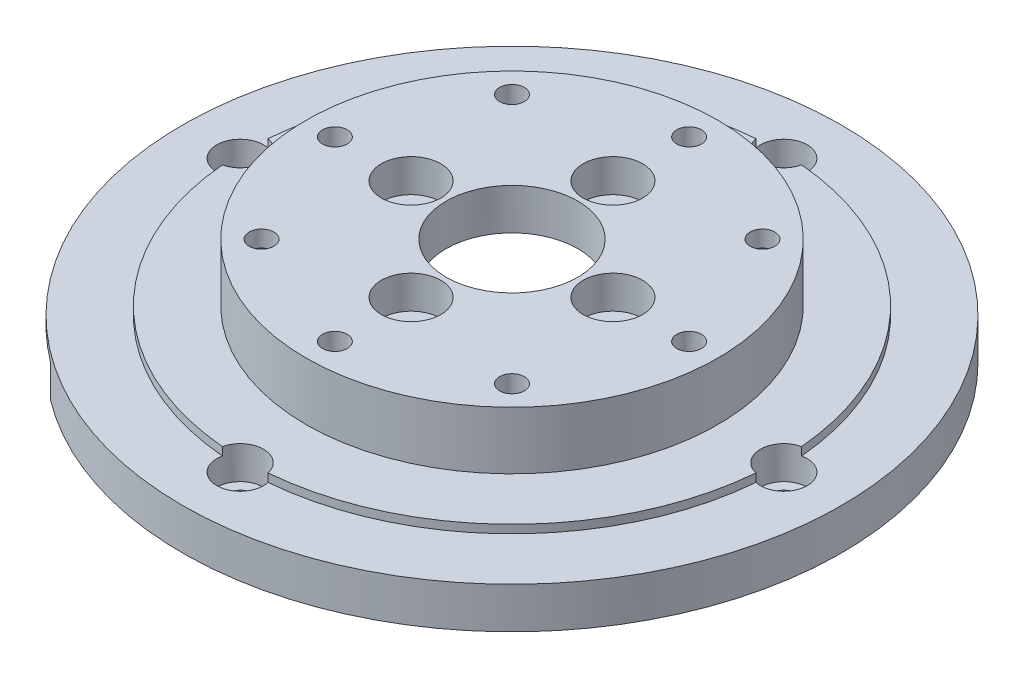
from build123d import *

# Parameters (mm, degrees)
SKETCH1_R           = 40
BOSS_EXTRUDE1_DEPTH = 5
SKETCH4_R           = 32.5
BOSS_EXTRUDE2_DEPTH = 1
SKETCH5_R           = 25
BOSS_EXTRUDE3_DEPTH = 7
SKETCH6_R           = 2
SKETCH6_R_2         = 8
CUT_EXTRUDE1_DEPTH  = 59.043087444
SKETCH7_R           = 30
CUT_EXTRUDE2_DEPTH  = 4
SKETCH8_R           = 24
CUT_EXTRUDE3_DEPTH  = 4
SKETCH9_R           = 3.61
CUT_EXTRUDE4_DEPTH  = 4
SKETCH10_R          = 1.57
CUT_EXTRUDE5_DEPTH  = 59.043087444
SKETCH11_R          = 2.84
CUT_EXTRUDE6_DEPTH  = 4
SKETCH12_R          = 1.5
CUT_EXTRUDE7_DEPTH  = 4
CUT_EXTRUDE9_DEPTH  = 7
CUT_EXTRUDE10_DEPTH = 4


with BuildPart() as part:
    # Sketch1 → Boss-Extrude1 (new body)
    with BuildSketch(Plane(origin=(0, 0, 0), x_dir=(1, 0, 0), z_dir=(0, 1, 0))):
        with Locations(Location((0, 0, 0), (0, 0, 270))):
            Circle(SKETCH1_R)
    extrude(amount=BOSS_EXTRUDE1_DEPTH)

    # Sketch4 → Boss-Extrude2 (add)
    with BuildSketch(Plane(origin=(0, 5, 0), x_dir=(1, 0, 0), z_dir=(0, 1, 0))):
        with Locations(Location((0, 0, 0), (0, 0, 270))):
            Circle(SKETCH4_R)
    extrude(amount=BOSS_EXTRUDE2_DEPTH)

    # Sketch5 → Boss-Extrude3 (add)
    with BuildSketch(Plane(origin=(0, 6, 0), x_dir=(1, 0, 0), z_dir=(0, 1, 0))):
        with Locations(Location((0, 0, 0), (0, 0, 270))):
            Circle(SKETCH5_R)
    extrude(amount=BOSS_EXTRUDE3_DEPTH)

    # Sketch6 → Cut-Extrude1 (cut, through all)
    with BuildSketch(Plane(origin=(0, 13, 0), x_dir=(1, 0, 0), z_dir=(0, 1, 0))):
        with Locations(Location((12.25, 0, 0), (0, 0, 270))):
            Circle(SKETCH6_R)
        with Locations(Location((0, -12.25, 0), (0, 0, 270))):
            Circle(SKETCH6_R)
        with Locations(Location((-12.25, 0, 0), (0, 0, 270))):
            Circle(SKETCH6_R)
        with Locations(Location((0, 12.25, 0), (0, 0, 270))):
            Circle(SKETCH6_R)
        with Locations(Location((0, 0, 0), (0, 0, 270))):
            Circle(SKETCH6_R_2)
    extrude(amount=-CUT_EXTRUDE1_DEPTH, mode=Mode.SUBTRACT)

    # Sketch7 → Cut-Extrude2 (cut)
    with BuildSketch(Plane.XZ):
        with Locations(Location((0, 0, 0), (0, 0, 270))):
            Circle(SKETCH7_R)
    extrude(amount=-CUT_EXTRUDE2_DEPTH, mode=Mode.SUBTRACT)

    # Sketch8 → Cut-Extrude3 (cut)
    with BuildSketch(Plane.XZ.offset(-4)):
        with Locations(Location((0, 0, 0), (0, 0, 270))):
            Circle(SKETCH8_R)
    extrude(amount=-CUT_EXTRUDE3_DEPTH, mode=Mode.SUBTRACT)

    # Sketch9 → Cut-Extrude4 (cut)
    with BuildSketch(Plane(origin=(0, 13, 0), x_dir=(1, 0, 0), z_dir=(0, 1, 0))):
        with Locations(Location((0, 12.25, 0), (0, 0, 270))):
            Circle(SKETCH9_R)
        with Locations(Location((12.25, 0, 0), (0, 0, 270))):
            Circle(SKETCH9_R)
        with Locations(Location((0, -12.25, 0), (0, 0, 270))):
            Circle(SKETCH9_R)
        with Locations(Location((-12.25, 0, 0), (0, 0, 270))):
            Circle(SKETCH9_R)
    extrude(amount=-CUT_EXTRUDE4_DEPTH, mode=Mode.SUBTRACT)

    # Sketch10 → Cut-Extrude5 (cut, through all)
    with BuildSketch(Plane(origin=(0, 13, 0), x_dir=(1, 0, 0), z_dir=(0, 1, 0))):
        with Locations(Location((0, 33, 0), (0, 0, 270))):
            Circle(SKETCH10_R)
        with Locations(Location((33, 0, 0), (0, 0, 270))):
            Circle(SKETCH10_R)
        with Locations(Location((0, -33, 0), (0, 0, 270))):
            Circle(SKETCH10_R)
        with Locations(Location((-33, 0, 0), (0, 0, 270))):
            Circle(SKETCH10_R)
    extrude(amount=-CUT_EXTRUDE5_DEPTH, mode=Mode.SUBTRACT)

    # Sketch11 → Cut-Extrude6 (cut)
    with BuildSketch(Plane(origin=(0, 6, 0), x_dir=(1, 0, 0), z_dir=(0, 1, 0))):
        with Locations(Location((0, 33, 0), (0, 0, 270))):
            Circle(SKETCH11_R)
        with Locations(Location((33, 0, 0), (0, 0, 270))):
            Circle(SKETCH11_R)
        with Locations(Location((0, -33, 0), (0, 0, 270))):
            Circle(SKETCH11_R)
        with Locations(Location((-33, 0, 0), (0, 0, 270))):
            Circle(SKETCH11_R)
    extrude(amount=-CUT_EXTRUDE6_DEPTH, mode=Mode.SUBTRACT)

    # Sketch12 → Cut-Extrude7 (cut)
    with BuildSketch(Plane(origin=(0, 13, 0), x_dir=(1, 0, 0), z_dir=(0, 1, 0))):
        with Locations(Location((0, -21.5, 0), (0, 0, 270))):
            Circle(SKETCH12_R)
        with Locations(Location((-15.202795796, -15.202795796, 0), (0, 0, 270))):
            Circle(SKETCH12_R)
        with Locations(Location((-21.5, 0, 0), (0, 0, 270))):
            Circle(SKETCH12_R)
        with Locations(Location((-15.202795796, 15.202795796, 0), (0, 0, 270))):
            Circle(SKETCH12_R)
        with Locations(Location((0, 21.5, 0), (0, 0, 270))):
            Circle(SKETCH12_R)
        with Locations(Location((15.202795796, 15.202795796, 0), (0, 0, 270))):
            Circle(SKETCH12_R)
        with Locations(Location((21.5, 0, 0), (0, 0, 270))):
            Circle(SKETCH12_R)
        with Locations(Location((15.202795796, -15.202795796, 0), (0, 0, 270))):
            Circle(SKETCH12_R)
    extrude(amount=-CUT_EXTRUDE7_DEPTH, mode=Mode.SUBTRACT)

    # Sketch13 → Cut-Extrude9 (cut)
    with BuildSketch(Plane.XZ.offset(-4)):
        Polygon((15.202795796, -11.969634288), (12.402795796, -13.586215042), (12.402795796, -16.819376549), (15.202795796, -18.435957303), (18.002795796, -16.819376549), (18.002795796, -13.586215042), align=None)
        Polygon((-15.202795796, 11.969634288), (-12.402795796, 13.586215042), (-12.402795796, 16.819376549), (-15.202795796, 18.435957303), (-18.002795796, 16.819376549), (-18.002795796, 13.586215042), align=None)
    extrude(amount=-CUT_EXTRUDE9_DEPTH, mode=Mode.SUBTRACT)

    # Sketch14 → Cut-Extrude10 (cut)
    with BuildSketch(Plane.XZ):
        with BuildLine():
            ThreePointArc((-24.74274405, 16.964569457), (-21.213203436, 21.213203436), (-16.964569457, 24.74274405))
            Line((-16.964569457, 24.74274405), (-24.126533346, 31.904707939))
            ThreePointArc((-24.126533346, 31.904707939), (-28.284271247, 28.284271247), (-31.904707939, 24.126533346))
            Line((-31.904707939, 24.126533346), (-24.74274405, 16.964569457))
        make_face()
    extrude(amount=-CUT_EXTRUDE10_DEPTH, mode=Mode.SUBTRACT)


solid = part.part
